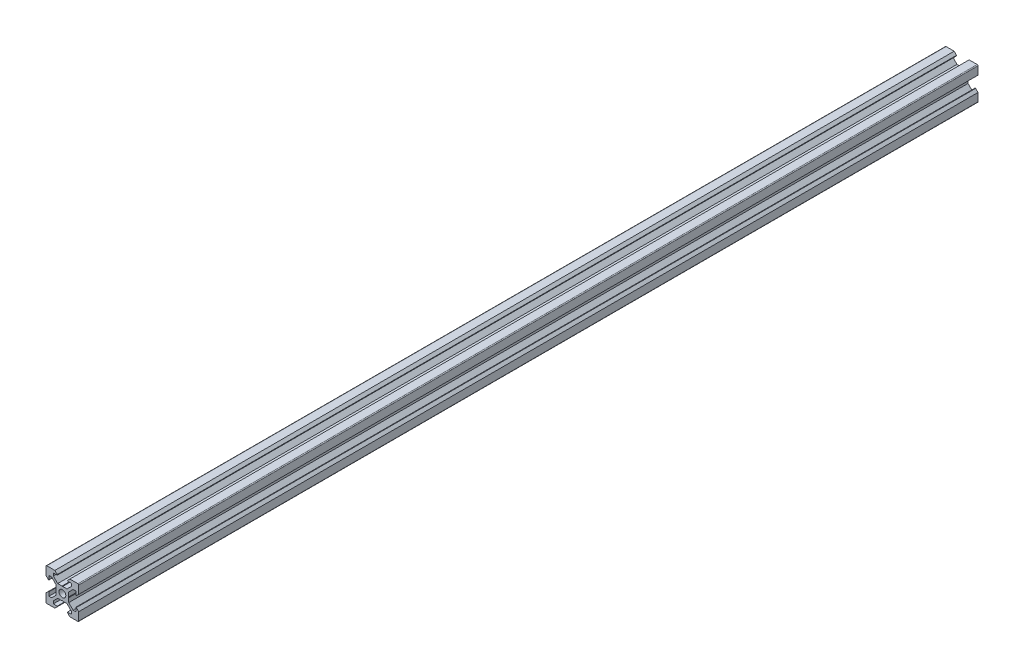
from build123d import *

# Parameters (mm, degrees)
SKETCH1_R           = 2.1
BOSS_EXTRUDE1_DEPTH = 550


with BuildPart() as part:
    # Sketch1 → Boss-Extrude1 (new body)
    with BuildSketch(Plane.XY):
        with BuildLine():
            Line((4.58, -10), (9.5, -10))
            ThreePointArc((9.5, -10), (9.853553391, -9.853553391), (10, -9.5))
            Line((10, -9.5), (10, -4.58))
            Line((10, -4.58), (8.545, -3.125))
            Line((8.545, -3.125), (8.2, -3.125))
            Line((8.2, -3.125), (8.2, -5.5))
            Line((8.2, -5.5), (6.560660172, -5.5))
            Line((6.560660172, -5.5), (3.9, -2.839339828))
            Line((3.9, -2.839339828), (3.9, -0.21))
            Line((3.9, -0.21), (3.69, 0))
            Line((3.69, 0), (3.9, 0.21))
            Line((3.9, 0.21), (3.9, 2.839339828))
            Line((3.9, 2.839339828), (6.560660172, 5.5))
            Line((6.560660172, 5.5), (8.2, 5.5))
            Line((8.2, 5.5), (8.2, 3.125))
            Line((8.2, 3.125), (8.545, 3.125))
            Line((8.545, 3.125), (10, 4.58))
            Line((10, 4.58), (10, 9.5))
            ThreePointArc((10, 9.5), (9.853553391, 9.853553391), (9.5, 10))
            Line((9.5, 10), (4.58, 10))
            Line((4.58, 10), (3.125, 8.545))
            Line((3.125, 8.545), (3.125, 8.2))
            Line((3.125, 8.2), (5.5, 8.2))
            Line((5.5, 8.2), (5.5, 6.560660172))
            Line((5.5, 6.560660172), (2.839339828, 3.9))
            Line((2.839339828, 3.9), (0.21, 3.9))
            Line((0.21, 3.9), (0, 3.69))
            Line((0, 3.69), (-0.21, 3.9))
            Line((-0.21, 3.9), (-2.839339828, 3.9))
            Line((-2.839339828, 3.9), (-5.5, 6.560660172))
            Line((-5.5, 6.560660172), (-5.5, 8.2))
            Line((-5.5, 8.2), (-3.125, 8.2))
            Line((-3.125, 8.2), (-3.125, 8.545))
            Line((-3.125, 8.545), (-4.58, 10))
            Line((-4.58, 10), (-9.5, 10))
            ThreePointArc((-9.5, 10), (-9.853553391, 9.853553391), (-10, 9.5))
            Line((-10, 9.5), (-10, 4.58))
            Line((-10, 4.58), (-8.545, 3.125))
            Line((-8.545, 3.125), (-8.2, 3.125))
            Line((-8.2, 3.125), (-8.2, 5.5))
            Line((-8.2, 5.5), (-6.560660172, 5.5))
            Line((-6.560660172, 5.5), (-3.9, 2.839339828))
            Line((-3.9, 2.839339828), (-3.9, 0.21))
            Line((-3.9, 0.21), (-3.69, 0))
            Line((-3.69, 0), (-3.9, -0.21))
            Line((-3.9, -0.21), (-3.9, -2.839339828))
            Line((-3.9, -2.839339828), (-6.560660172, -5.5))
            Line((-6.560660172, -5.5), (-8.2, -5.5))
            Line((-8.2, -5.5), (-8.2, -3.125))
            Line((-8.2, -3.125), (-8.545, -3.125))
            Line((-8.545, -3.125), (-10, -4.58))
            Line((-10, -4.58), (-10, -9.5))
            ThreePointArc((-10, -9.5), (-9.853553391, -9.853553391), (-9.5, -10))
            Line((-9.5, -10), (-4.58, -10))
            Line((-4.58, -10), (-3.125, -8.545))
            Line((-3.125, -8.545), (-3.125, -8.2))
            Line((-3.125, -8.2), (-5.5, -8.2))
            Line((-5.5, -8.2), (-5.5, -6.560660172))
            Line((-5.5, -6.560660172), (-2.839339828, -3.9))
            Line((-2.839339828, -3.9), (-0.21, -3.9))
            Line((-0.21, -3.9), (0, -3.69))
            Line((0, -3.69), (0.21, -3.9))
            Line((0.21, -3.9), (2.839339828, -3.9))
            Line((2.839339828, -3.9), (5.5, -6.560660172))
            Line((5.5, -6.560660172), (5.5, -8.2))
            Line((5.5, -8.2), (3.125, -8.2))
            Line((3.125, -8.2), (3.125, -8.545))
            Line((3.125, -8.545), (4.58, -10))
        make_face()
        Circle(SKETCH1_R, mode=Mode.SUBTRACT)
    extrude(amount=BOSS_EXTRUDE1_DEPTH)


solid = part.part
